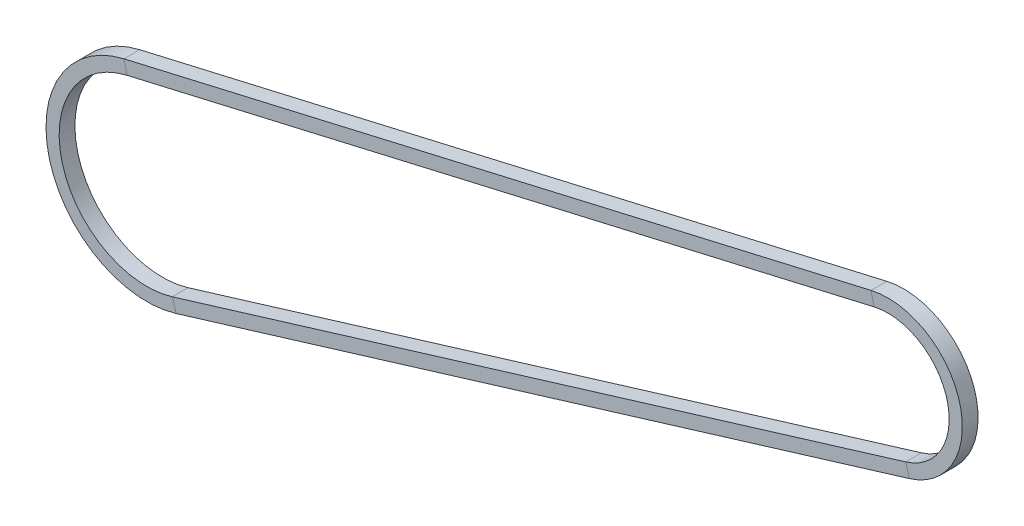
from build123d import *

# Parameters (mm, degrees)
SKETCH3_W = 0.9
SKETCH3_H = 0.75


with BuildPart() as part:
    # Sweep1: sweep along a path in Sketch2
    with BuildLine(Plane.XY) as sweep1_path:
        Line((1.021151678, -3.347722995), (-40.834897509, -16.115020328))
        ThreePointArc((-40.834897509, -16.115020328), (-47.123314752, -12.626654132), (-43.421568768, -6.461431768))
        Line((-43.421568768, -6.461431768), (-0.789518203, 3.409788997))
        ThreePointArc((-0.789518203, 3.409788997), (3.380740392, 0.905866658), (1.021151678, -3.347722995))
    # Sketch3 → Sweep1 (sweep)
    with BuildSketch(Plane(origin=(-43.421568768, -6.461431768, 0), x_dir=(0, 0, -1), z_dir=(0.9742254278362672, 0.22557662945713677, 0))):
        with Locations((0, 0.375)):
            Rectangle(SKETCH3_W, SKETCH3_H)
    sweep(path=sweep1_path.line)


solid = part.part
